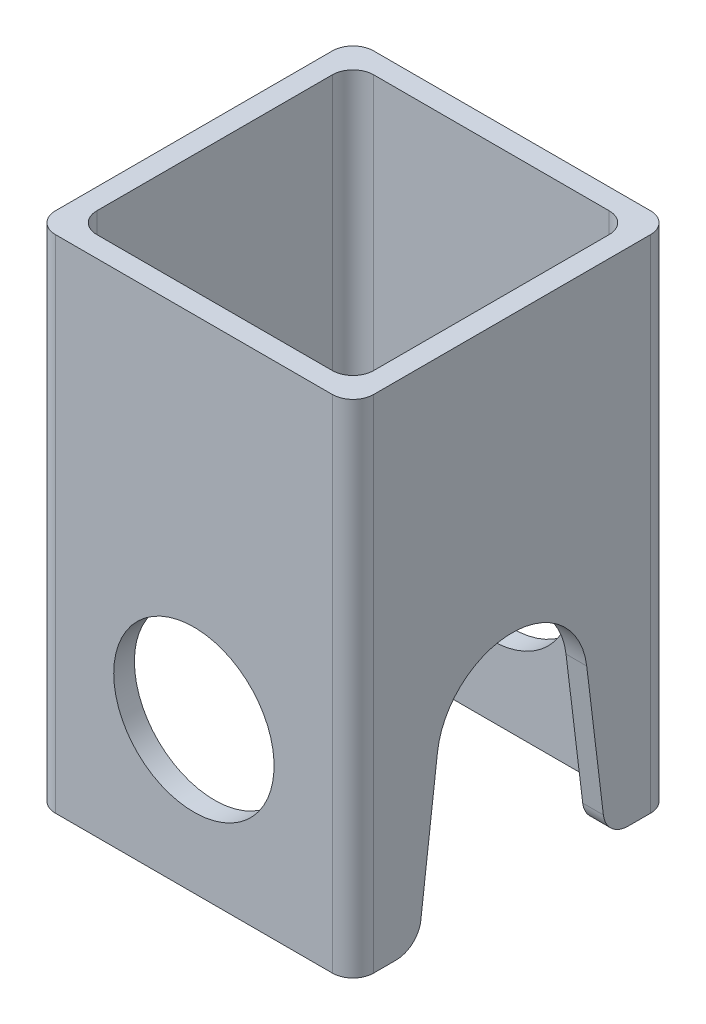
from build123d import *

# Parameters (mm, degrees)
FSAE_CHASSIS_MCMASTER_4130_1IN_X_065IN_DEPTH = 40
CUT_EXTRUDE1_DEPTH                           = 50.055580722
CUT_EXTRUDE1_DEPTH_BACK                      = 50.055580722
SKETCH3_R                                    = 6.4
CUT_EXTRUDE2_DEPTH                           = 50.055580722
CUT_EXTRUDE2_DEPTH_BACK                      = 50.055580722
FILLET1_R                                    = 2


with BuildPart() as part:
    # Sketch2 → Fsae chassis MCMASTER 4130 1IN X .065IN SQUARE STOCK(1) (new body)
    with BuildSketch(Plane.ZX):
        with BuildLine():
            Line((11.049, 12.7), (-11.049, 12.7))
            ThreePointArc((-11.049, 12.7), (-12.216433296, 12.216433296), (-12.7, 11.049))
            Line((-12.7, 11.049), (-12.7, -11.049))
            ThreePointArc((-12.7, -11.049), (-12.216433296, -12.216433296), (-11.049, -12.7))
            Line((-11.049, -12.7), (11.049, -12.7))
            ThreePointArc((11.049, -12.7), (12.216433296, -12.216433296), (12.7, -11.049))
            Line((12.7, -11.049), (12.7, 11.049))
            ThreePointArc((12.7, 11.049), (12.216433296, 12.216433296), (11.049, 12.7))
        make_face()
        with BuildLine():
            Line((-9.398, 11.049), (9.398, 11.049))
            ThreePointArc((9.398, 11.049), (10.565433296, 10.565433296), (11.049, 9.398))
            Line((11.049, 9.398), (11.049, -9.398))
            ThreePointArc((11.049, -9.398), (10.565433296, -10.565433296), (9.398, -11.049))
            Line((9.398, -11.049), (-9.398, -11.049))
            ThreePointArc((-9.398, -11.049), (-10.565433296, -10.565433296), (-11.049, -9.398))
            Line((-11.049, -9.398), (-11.049, 9.398))
            ThreePointArc((-11.049, 9.398), (-10.565433296, 10.565433296), (-9.398, 11.049))
        make_face(mode=Mode.SUBTRACT)
    extrude(amount=FSAE_CHASSIS_MCMASTER_4130_1IN_X_065IN_DEPTH)

    # Sketch3 → Cut-Extrude1 (cut, two sides: drawn at the far end of the back side and taken through both)
    with BuildSketch(Plane.XY.offset(12.7).offset(-CUT_EXTRUDE1_DEPTH_BACK)):
        with Locations((0, 12)):
            Circle(SKETCH3_R)
    extrude(amount=CUT_EXTRUDE1_DEPTH + CUT_EXTRUDE1_DEPTH_BACK, mode=Mode.SUBTRACT)

    # Sketch4 → Cut-Extrude2 (cut, two sides: drawn at the far end of the back side and taken through both)
    with BuildSketch(Plane(origin=(12.7, 0, 0), x_dir=(0, 0, -1), z_dir=(1, 0, 0)).offset(-CUT_EXTRUDE2_DEPTH_BACK)):
        with BuildLine():
            Line((-7.5, 0), (7.5, 0))
            Line((7.5, 0), (5.956316627, 12.722697892))
            ThreePointArc((5.956316627, 12.722697892), (0, 18), (-5.956316627, 12.722697892))
            Line((-5.956316627, 12.722697892), (-7.5, 0))
        make_face()
    extrude(amount=CUT_EXTRUDE2_DEPTH + CUT_EXTRUDE2_DEPTH_BACK, mode=Mode.SUBTRACT)

    # Fillet1
    fillet1_edges = [part.edges().sort_by_distance(p)[0] for p in [
        (11.8745, 0, 7.5),
        (11.8745, 0, -7.5),
        (-11.8745, 0, -7.5),
        (-11.8745, 0, 7.5),
    ]]
    fillet(fillet1_edges, radius=FILLET1_R)


solid = part.part
